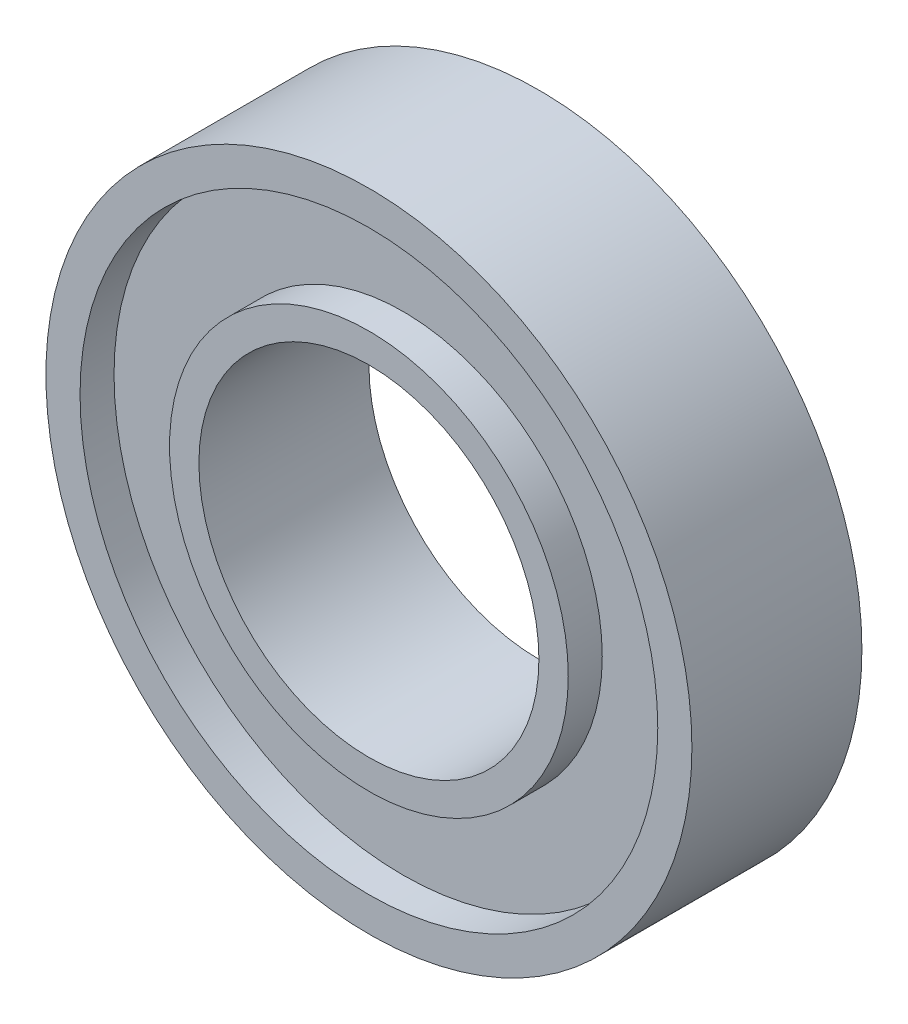
from build123d import *

# Parameters (mm, degrees)
SKETCH_1_R          = 9.5
SKETCH_1_R_2        = 5
EXTRUDE_1_DEPTH     = 5
SKETCH_2_R          = 8.496230793
SKETCH_2_R_2        = 5.863363984
CUT_EXTRUDE_1_DEPTH = 1


with BuildPart() as part:
    # 草图1 → 凸台-拉伸1 (new body)
    with BuildSketch(Plane.XY):
        Circle(SKETCH_1_R)
        Circle(SKETCH_1_R_2, mode=Mode.SUBTRACT)
    extrude(amount=EXTRUDE_1_DEPTH)

    # 草图2 → 切除-拉伸1 (cut)
    with BuildSketch(Plane.XY.offset(5)):
        Circle(SKETCH_2_R)
        Circle(SKETCH_2_R_2, mode=Mode.SUBTRACT)
    cut_extrude_1 = extrude(amount=-CUT_EXTRUDE_1_DEPTH, mode=Mode.SUBTRACT)

    # 镜向2: 切除-拉伸1 across plane
    add(cut_extrude_1.mirror(Plane.XY.offset(2.5)), mode=Mode.SUBTRACT)


solid = part.part
